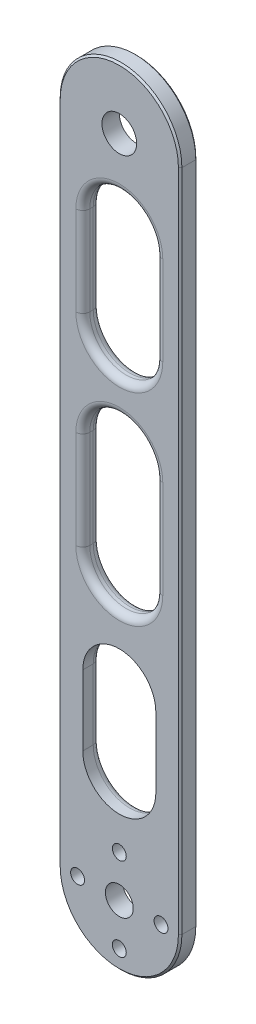
from build123d import *

# Parameters (mm, degrees)
SKETCH1_R           = 4
SKETCH1_R_2         = 2
SKETCH1_R_3         = 4.99
BOSS_EXTRUDE1_DEPTH = 5
FILLET1_R           = 2
FILLET2_R           = 2
FILLET3_R           = 2
FILLET4_R           = 2
FILLET6_R           = 2
CHAMFER3_SIZE       = 0.5
CHAMFER4_SIZE       = 0.5


with BuildPart() as part:
    # Sketch1 → Boss-Extrude1 (new body)
    with BuildSketch(Plane.XY):
        with BuildLine():
            Line((17.5, 191), (17.5, 0))
            ThreePointArc((17.5, 0), (0, -17.5), (-17.5, 0))
            Line((-17.5, 0), (-17.5, 191))
            ThreePointArc((-17.5, 191), (0, 208.5), (17.5, 191))
        make_face()
        Circle(SKETCH1_R, mode=Mode.SUBTRACT)
        with Locations((12, 0)):
            Circle(SKETCH1_R_2, mode=Mode.SUBTRACT)
        with Locations((0, -12)):
            Circle(SKETCH1_R_2, mode=Mode.SUBTRACT)
        with Locations((-12, 0)):
            Circle(SKETCH1_R_2, mode=Mode.SUBTRACT)
        with Locations((0, 12)):
            Circle(SKETCH1_R_2, mode=Mode.SUBTRACT)
        with Locations((0, 191)):
            Circle(SKETCH1_R_3, mode=Mode.SUBTRACT)
        with BuildLine():
            Line((10.5, 166), (10.5, 140.348706627))
            ThreePointArc((10.5, 140.348706627), (0, 129.848706627), (-10.5, 140.348706627))
            Line((-10.5, 140.348706627), (-10.5, 166))
            ThreePointArc((-10.5, 166), (0, 176.5), (10.5, 166))
        make_face(mode=Mode.SUBTRACT)
        with BuildLine():
            Line((10.5, 110.348706627), (10.5, 82.179664366))
            ThreePointArc((10.5, 82.179664366), (0, 71.679664366), (-10.5, 82.179664366))
            Line((-10.5, 82.179664366), (-10.5, 110.348706627))
            ThreePointArc((-10.5, 110.348706627), (0, 120.848706627), (10.5, 110.348706627))
        make_face(mode=Mode.SUBTRACT)
        with BuildLine():
            Line((10.5, 52.179664366), (10.5, 32))
            ThreePointArc((10.5, 32), (0, 21.5), (-10.5, 32))
            Line((-10.5, 32), (-10.5, 52.179664366))
            ThreePointArc((-10.5, 52.179664366), (0, 62.679664366), (10.5, 52.179664366))
        make_face(mode=Mode.SUBTRACT)
    extrude(amount=BOSS_EXTRUDE1_DEPTH)

    # Fillet1
    fillet1_edges = [part.edges().sort_by_distance(p)[0] for p in [
        (0, 176.5, 5),
        (-10.5, 153.174353313, 5),
        (0, 129.848706627, 5),
        (10.5, 153.174353313, 5),
    ]]
    fillet(fillet1_edges, radius=FILLET1_R)

    # Fillet2
    fillet2_edges = [part.edges().sort_by_distance(p)[0] for p in [
        (0, 176.5, 0),
        (-10.5, 153.174353313, 0),
        (0, 129.848706627, 0),
        (10.5, 153.174353313, 0),
    ]]
    fillet(fillet2_edges, radius=FILLET2_R)

    # Fillet3
    fillet3_edges = [part.edges().sort_by_distance(p)[0] for p in [
        (0, 120.848706627, 0),
        (-10.5, 96.264185496, 0),
        (0, 71.679664366, 0),
        (10.5, 96.264185496, 0),
    ]]
    fillet(fillet3_edges, radius=FILLET3_R)

    # Fillet4
    fillet4_edges = [part.edges().sort_by_distance(p)[0] for p in [
        (0, 120.848706627, 5),
        (-10.5, 96.264185496, 5),
        (0, 71.679664366, 5),
        (10.5, 96.264185496, 5),
    ]]
    fillet(fillet4_edges, radius=FILLET4_R)

    # Fillet6
    fillet6_edges = [part.edges().sort_by_distance(p)[0] for p in [
        (0, 62.679664366, 0),
        (-10.5, 42.089832183, 0),
        (0, 21.5, 0),
        (10.5, 42.089832183, 0),
    ]]
    fillet(fillet6_edges, radius=FILLET6_R)

    # Chamfer3
    chamfer3_edges = [part.edges().sort_by_distance(p)[0] for p in [
        (17.5, 95.5, 0),
        (0, -17.5, 0),
        (-17.5, 95.5, 0),
        (0, 208.5, 0),
    ]]
    chamfer(chamfer3_edges, length=CHAMFER3_SIZE)

    # Chamfer4
    chamfer4_edges = [part.edges().sort_by_distance(p)[0] for p in [
        (0, -17.5, 5),
        (17.5, 95.5, 5),
        (0, 208.5, 5),
        (-17.5, 95.5, 5),
    ]]
    chamfer(chamfer4_edges, length=CHAMFER4_SIZE)


solid = part.part
